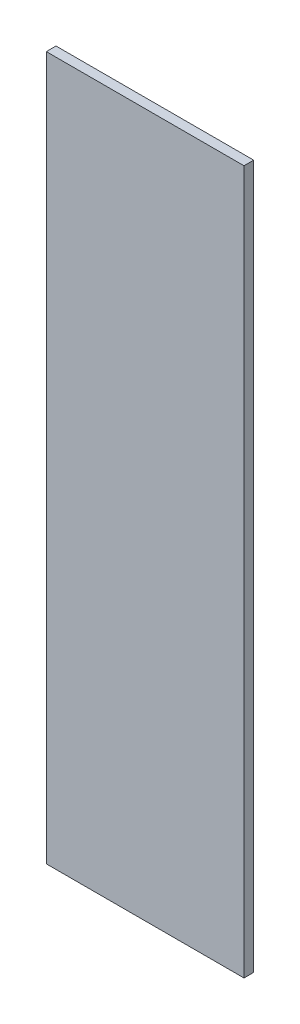
from build123d import *

# Parameters (mm, degrees)
SKETCH_1_W      = 81.5
SKETCH_1_H      = 290
EXTRUDE_1_DEPTH = 4


with BuildPart() as part:
    # 草图1 → 凸台-拉伸1 (new body)
    with BuildSketch(Plane.XY):
        Rectangle(SKETCH_1_W, SKETCH_1_H)
    extrude(amount=EXTRUDE_1_DEPTH)


solid = part.part
